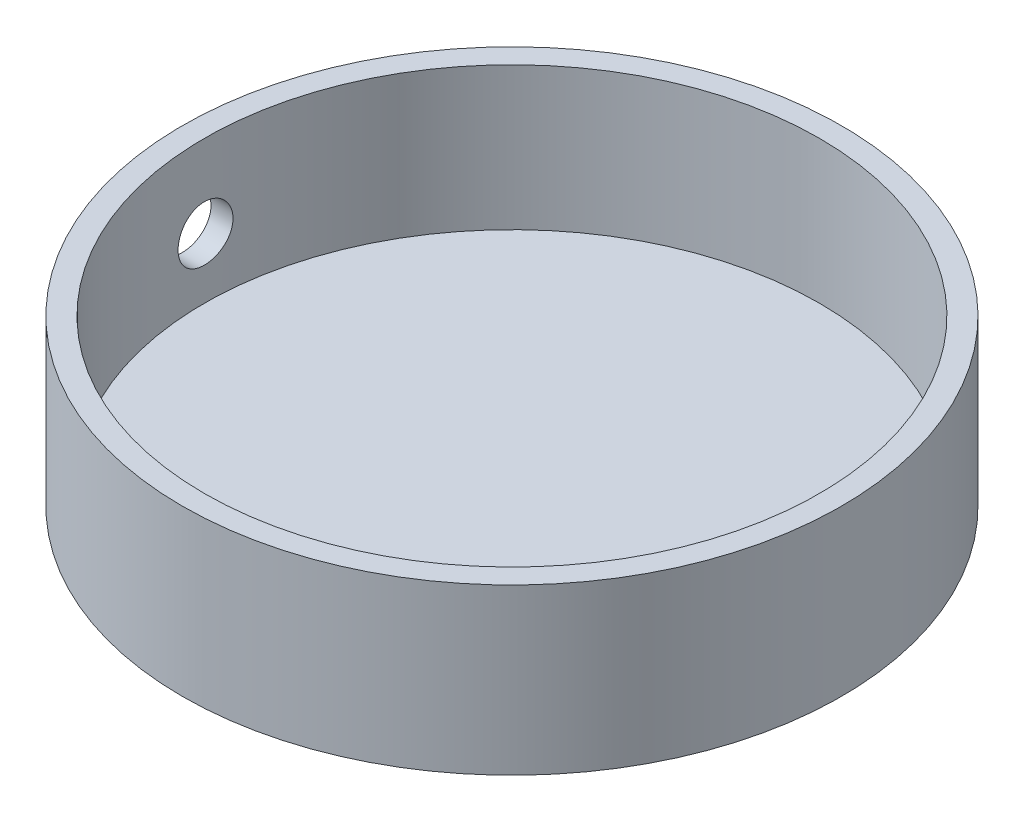
from build123d import *

# Parameters (mm, degrees)
SKETCH1_R               = 38.1
BOSS_EXTRUDE1_DEPTH     = 2.54
SKETCH2_R               = 38.1
SKETCH2_R_2             = 35.56
BOSS_EXTRUDE2_DEPTH     = 16.51
CUT_EXTRUDE1_REACH      = 89.298
CUT_EXTRUDE1_END_RADIUS = 35.56
SKETCH3_R               = 3.175


with BuildPart() as part:
    # Sketch1 → Boss-Extrude1 (new body)
    with BuildSketch(Plane(origin=(0, 0, 0), x_dir=(1, 0, 0), z_dir=(0, 1, 0))):
        with Locations(Location((0, 0, 0), (0, 0, 270))):
            Circle(SKETCH1_R)
    extrude(amount=BOSS_EXTRUDE1_DEPTH)

    # Sketch2 → Boss-Extrude2 (add)
    with BuildSketch(Plane(origin=(0, 2.54, 0), x_dir=(1, 0, 0), z_dir=(0, 1, 0))):
        with Locations(Location((0, 0, 0), (0, 0, 270))):
            Circle(SKETCH2_R)
        with Locations(Location((0, 0, 0), (0, 0, 270))):
            Circle(SKETCH2_R_2, mode=Mode.SUBTRACT)
    extrude(amount=BOSS_EXTRUDE2_DEPTH)

    # Cut-Extrude1: up to this cylinder (the profile starts outside it)
    cut_extrude1_end = Plane(origin=(0, 9.525, 0), z_dir=(0, -1, 0)) * Cylinder(CUT_EXTRUDE1_END_RADIUS, 250.716, mode=Mode.PRIVATE)
    # Sketch3 → Cut-Extrude1 (cut, up to the surface)
    with BuildSketch(Plane.ZY.offset(38.1), mode=Mode.PRIVATE) as cut_extrude1_sk1:
        with Locations((0, 9.525)):
            Circle(SKETCH3_R)
    cut_extrude1_tool1 = extrude(cut_extrude1_sk1.sketch, amount=-CUT_EXTRUDE1_REACH, mode=Mode.PRIVATE) - cut_extrude1_end
    add(cut_extrude1_tool1.solids().sort_by_distance((-38.1, 9.525, 0))[0], mode=Mode.SUBTRACT)


solid = part.part
